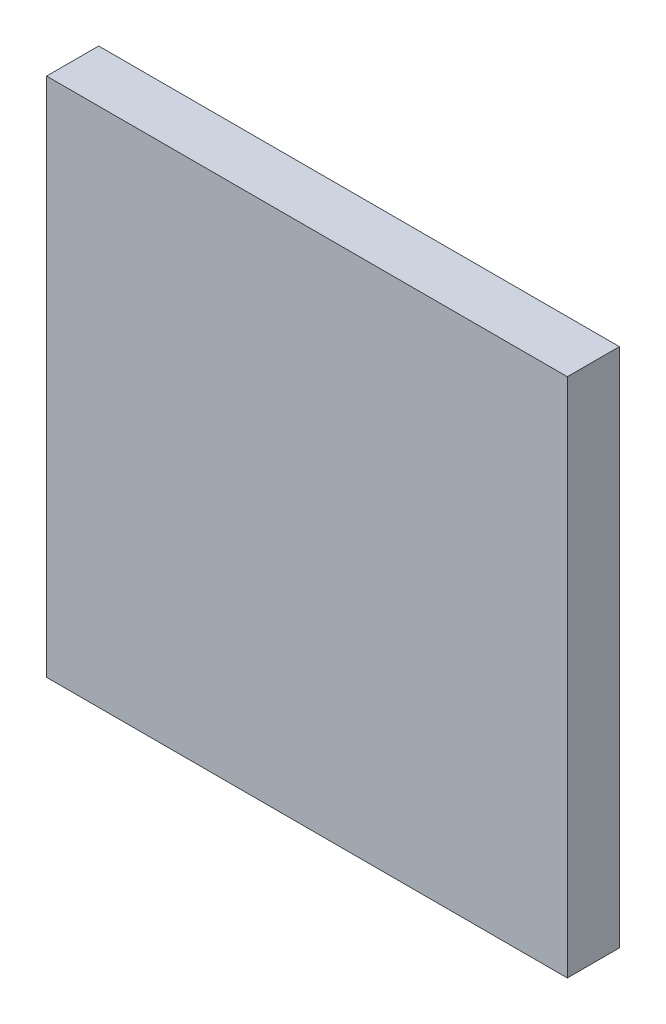
from build123d import *

# Parameters (mm, degrees)
ESQUISSE1_W        = 300
ESQUISSE1_H        = 300
BOSS_EXTRU_1_DEPTH = 30


with BuildPart() as part:
    # Esquisse1 → Boss.-Extru.1 (new body)
    with BuildSketch(Plane.XY):
        with Locations((150, 150)):
            Rectangle(ESQUISSE1_W, ESQUISSE1_H)
    extrude(amount=BOSS_EXTRU_1_DEPTH)


solid = part.part
